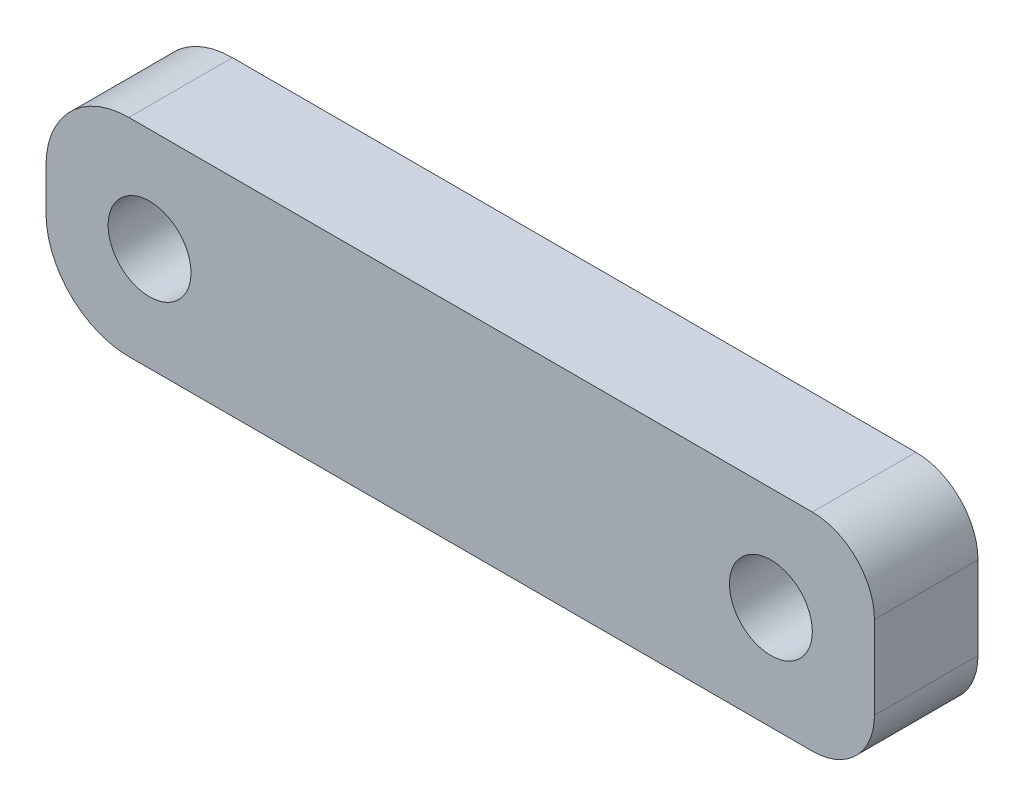
from build123d import *

# Parameters (mm, degrees)
SKETCH_1_R      = 2
EXTRUDE_1_DEPTH = 5


with BuildPart() as part:
    # 草图1 → 凸台-拉伸1 (new body)
    with BuildSketch(Plane.XY):
        with BuildLine():
            Line((4, 0), (37, 0))
            ThreePointArc((37, 0), (39.121320344, -0.878679656), (40, -3))
            Line((40, -3), (40, -7))
            ThreePointArc((40, -7), (39.121320344, -9.121320344), (37, -10))
            Line((37, -10), (4, -10))
            ThreePointArc((4, -10), (1.171572875, -8.828427125), (0, -6))
            Line((0, -6), (0, -4))
            ThreePointArc((0, -4), (1.171572875, -1.171572875), (4, 0))
        make_face()
        with Locations((35, -5)):
            Circle(SKETCH_1_R, mode=Mode.SUBTRACT)
        with Locations((5, -5)):
            Circle(SKETCH_1_R, mode=Mode.SUBTRACT)
    extrude(amount=EXTRUDE_1_DEPTH)


solid = part.part
